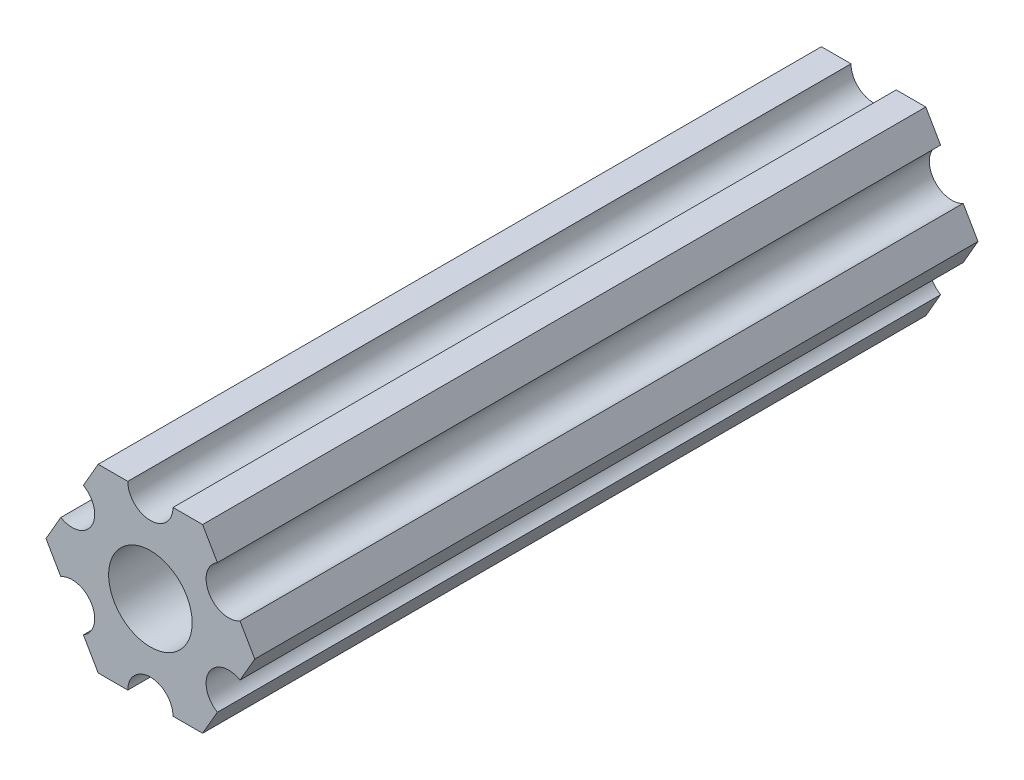
from build123d import *

# Parameters (mm, degrees)
SKETCH1_R           = 2.9337
BOSS_EXTRUDE2_DEPTH = 50.8


with BuildPart() as part:
    # Sketch1 → Boss-Extrude2 (new body)
    with BuildSketch(Plane(origin=(0, 0, 0), x_dir=(-1, 0, 0), z_dir=(0, 0, -1))):
        with BuildLine():
            Line((-4.70551159, -4.549815043), (-3.666174521, -6.349999904))
            Line((-3.666174521, -6.349999904), (-1.587500385, -6.349999904))
            ThreePointArc((-1.587500385, -6.349999904), (-3.85e-07, -4.762499904), (1.587499615, -6.349999904))
            Line((1.587499615, -6.349999904), (3.666173825, -6.349999904))
            Line((3.666173825, -6.349999904), (4.705510929, -4.549815232))
            ThreePointArc((4.705510929, -4.549815232), (4.124445601, -2.381249904), (6.293010929, -1.800184575))
            Line((6.293010929, -1.800184575), (7.332348034, 9.6e-08))
            Line((7.332348034, 9.6e-08), (6.293011178, 1.800184715))
            ThreePointArc((6.293011178, 1.800184715), (4.124445902, 2.381250241), (4.705511428, 4.549815516))
            Line((4.705511428, 4.549815516), (3.666174521, 6.350000222))
            Line((3.666174521, 6.350000222), (1.587500385, 6.350000222))
            ThreePointArc((1.587500385, 6.350000222), (3.85e-07, 4.762500222), (-1.587499615, 6.350000222))
            Line((-1.587499615, 6.350000222), (-3.666173825, 6.350000222))
            Line((-3.666173825, 6.350000222), (-4.705511038, 4.549815614))
            ThreePointArc((-4.705511038, 4.549815614), (-4.124445841, 2.38125025), (-6.293011205, 1.800185053))
            Line((-6.293011205, 1.800185053), (-7.332348419, 4.44e-07))
            Line((-7.332348419, 4.44e-07), (-6.293011423, -1.80018429))
            ThreePointArc((-6.293011423, -1.80018429), (-4.12444613, -2.38124975), (-4.70551159, -4.549815043))
        make_face()
        with Locations(Location((0, 0, 0), (0, 0, 180))):
            Circle(SKETCH1_R, mode=Mode.SUBTRACT)
    extrude(amount=BOSS_EXTRUDE2_DEPTH)


solid = part.part
